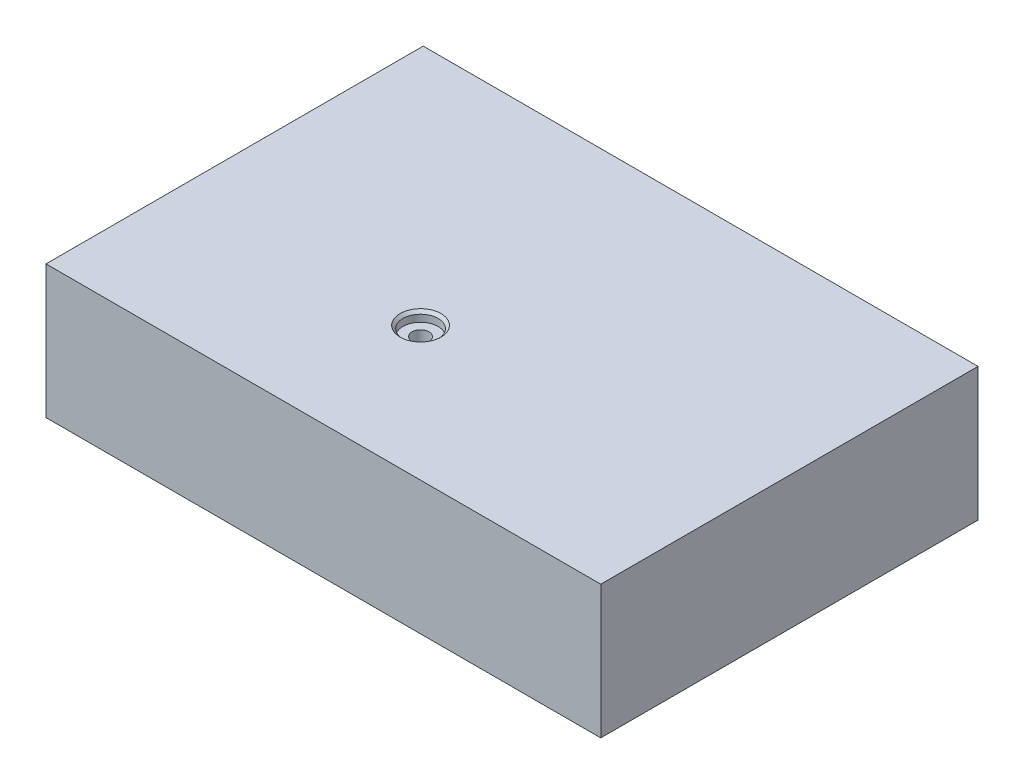
from build123d import *

# Parameters (mm, degrees)
SKETCH1_W           = 125
SKETCH1_H           = 85
BOSS_EXTRUDE1_DEPTH = 30


with BuildPart() as part:
    # Sketch1 → Boss-Extrude1 (new body)
    with BuildSketch(Plane(origin=(0, 0, 0), x_dir=(1, 0, 0), z_dir=(0, 1, 0))):
        with Locations((-18.606783327, -3.552156635)):
            Rectangle(SKETCH1_W, SKETCH1_H)
    extrude(amount=BOSS_EXTRUDE1_DEPTH)

    # Sketch2 → CBORE for #6 Binding Head Machine Screw1 (revolve, cut)
    with BuildSketch(Plane(origin=(-26.921037191, 30, 15.846157579), x_dir=(0, 0, 1), z_dir=(1, 0, 0))):
        Polygon((0, 0), (0, 30), (1.89865, 30), (1.89865, 2.2098), (3.96875, 2.2098), (3.96875, 0.635), (4.60375, 0), align=None)
    revolve(axis=Axis((-26.921037191, 36.35, 15.846157579), (0, -1, 0)), mode=Mode.SUBTRACT)


solid = part.part
